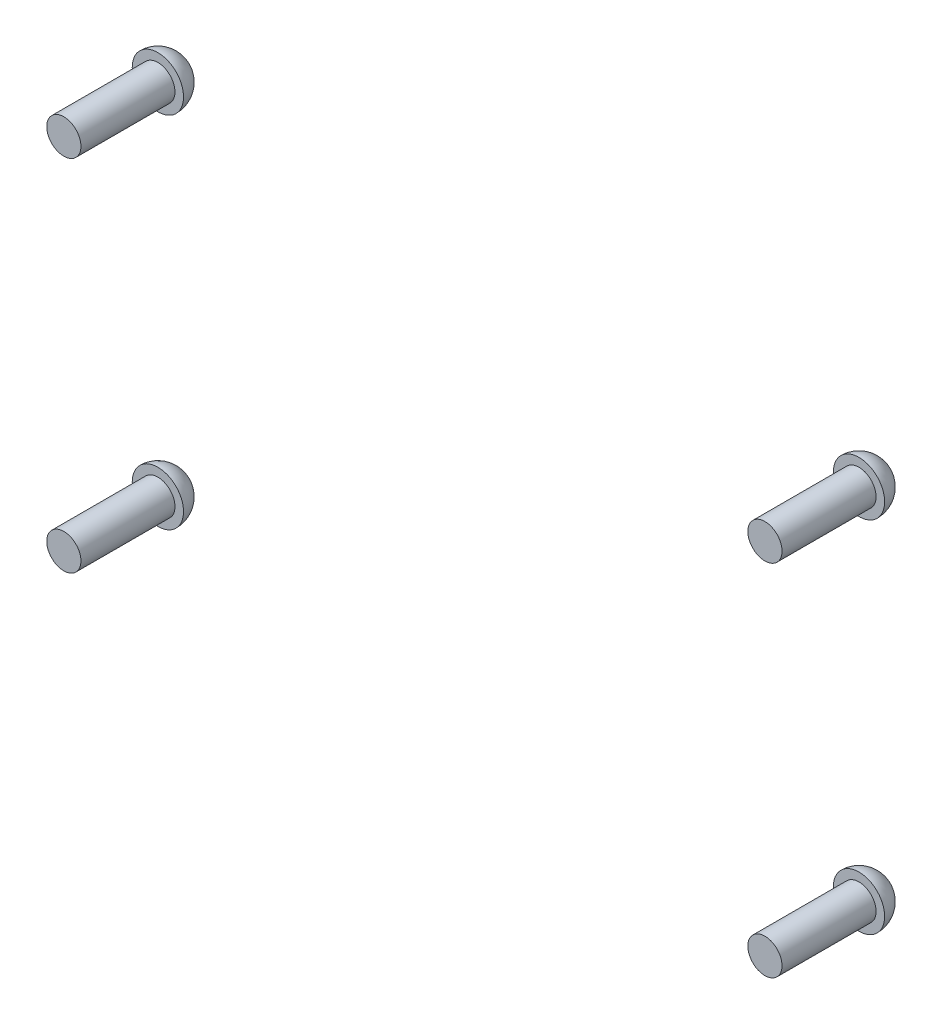
from build123d import *

# Parameters (mm, degrees)
SKETCH_1_R        = 10
EXTRUDE_3_DEPTH   = 55
EXTRUDE_3_2_DEPTH = 55
EXTRUDE_3_3_DEPTH = 55
EXTRUDE_3_4_DEPTH = 55
SKETCH_6_R        = 15
EXTRUDE_5_DEPTH   = 15
FILLET_16_R       = 14.99
FILLET_17_R       = 14.99
FILLET_18_R       = 14.99
FILLET_19_R       = 14.99


with BuildPart() as part:
    # 草图1 → 凸台-拉伸3 (new body)
    with BuildSketch(Plane.XY):
        with Locations((-45.368653632, 33.719938004)):
            Circle(SKETCH_1_R)
    extrude(amount=EXTRUDE_3_DEPTH)



with BuildPart() as body_2:
    # 草图1 → Extrude 3 2 (new body)
    with BuildSketch(Plane.XY):
        with Locations((364.631346368, 33.719938004)):
            Circle(SKETCH_1_R)
    extrude(amount=EXTRUDE_3_2_DEPTH)


with BuildPart() as body_3:
    # 草图1 → Extrude 3 3 (new body)
    with BuildSketch(Plane.XY):
        with Locations((-45.368653632, -176.280061996)):
            Circle(SKETCH_1_R)
    extrude(amount=EXTRUDE_3_3_DEPTH)


with BuildPart() as body_4:
    # 草图1 → Extrude 3 4 (new body)
    with BuildSketch(Plane.XY):
        with Locations((364.631346368, -176.280061996)):
            Circle(SKETCH_1_R)
    extrude(amount=EXTRUDE_3_4_DEPTH)


with BuildPart() as part_1:
    add(part.part)

    add(body_2.part)  # 凸台-拉伸5 merges body 2

    add(body_3.part)  # 凸台-拉伸5 merges body 3

    add(body_4.part)  # 凸台-拉伸5 merges body 4
    # 草图6 → 凸台-拉伸5 (add)
    with BuildSketch(Plane(origin=(0, 0, 0), x_dir=(-1, 0, 0), z_dir=(0, 0, -1))):
        with Locations((-364.631346368, 33.719938004)):
            Circle(SKETCH_6_R)
        with Locations((45.368653632, -176.280061996)):
            Circle(SKETCH_6_R)
        with Locations((45.368653632, 33.719938004)):
            Circle(SKETCH_6_R)
        with Locations((-364.631346368, -176.280061996)):
            Circle(SKETCH_6_R)
    extrude(amount=EXTRUDE_5_DEPTH)

    # 圆角16
    fillet_16_edges = [part_1.edges().sort_by_distance(p)[0] for p in [
        (379.631346368, -176.280061996, -15),
    ]]
    fillet(fillet_16_edges, radius=FILLET_16_R)

    # 圆角17
    fillet_17_edges = [part_1.edges().sort_by_distance(p)[0] for p in [
        (-30.368653632, -176.280061996, -15),
    ]]
    fillet(fillet_17_edges, radius=FILLET_17_R)

    # 圆角18
    fillet_18_edges = [part_1.edges().sort_by_distance(p)[0] for p in [
        (-30.368653632, 33.719938004, -15),
    ]]
    fillet(fillet_18_edges, radius=FILLET_18_R)

    # 圆角19
    fillet_19_edges = [part_1.edges().sort_by_distance(p)[0] for p in [
        (379.631346368, 33.719938004, -15),
    ]]
    fillet(fillet_19_edges, radius=FILLET_19_R)


solid = part_1.part
